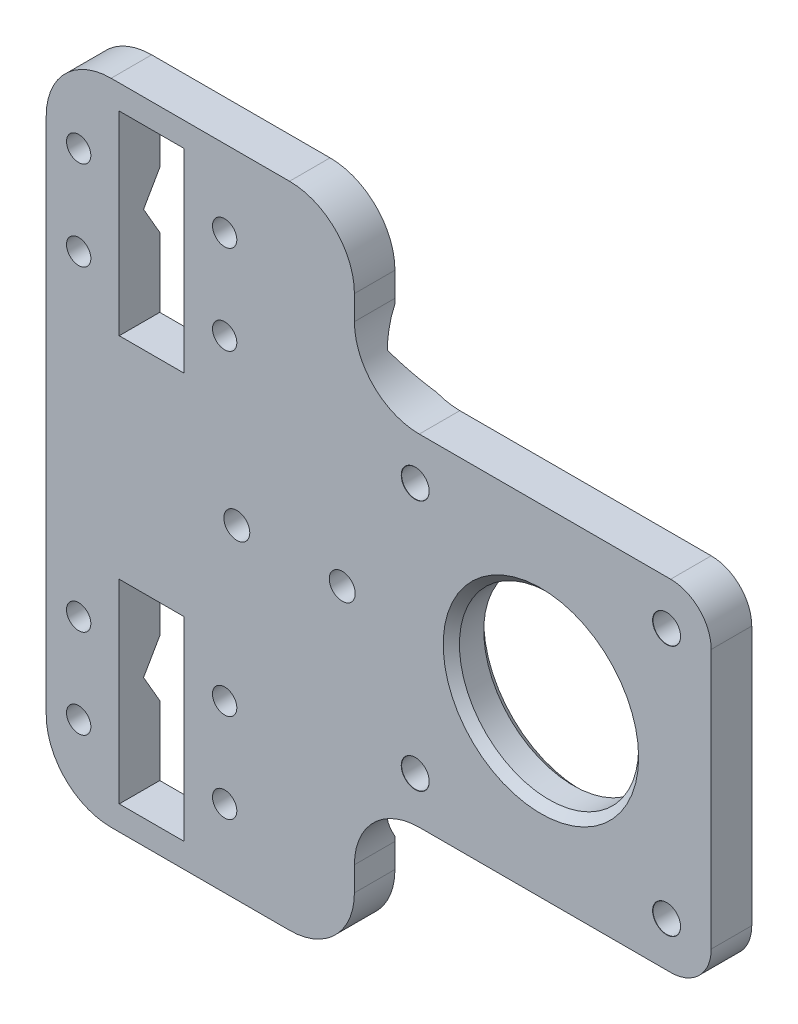
from build123d import *

# Parameters (mm, degrees)
ESBO_O1_W                                    = 82
ESBO_O1_H                                    = 80
ESBO_O1_R                                    = 1.5
ESBO_O1_W_2                                  = 8
ESBO_O1_H_2                                  = 24
RESSALTO_EXTRUS_O1_DEPTH                     = 5
CORTE_EXTRUS_O1_DEPTH                        = 92.372862492
ESCAREADO_PARA_PARAFUSO_COM_CABE_A_E_2_COUNT = 2
ESCAREADO_PARA_PARAFUSO_COM_CABE_A_E_2_PITCH = 31
ESCAREADO_PARA_PARAFUSO_COM_CABE_A_E_3_COUNT = 2
ESCAREADO_PARA_PARAFUSO_COM_CABE_A_E_3_PITCH = 43.840620434
ESCAREADO_PARA_PARAFUSO_COM_CABE_A_E_4_COUNT = 2
ESCAREADO_PARA_PARAFUSO_COM_CABE_A_E_4_PITCH = 31
ESBO_O5_R                                    = 11.05
CORTE_EXTRUS_O2_DEPTH                        = 58.497826046
CHANFRO1_SIZE                                = 1
ESBO_O6_W                                    = 44
ESBO_O6_H                                    = 19
CORTE_EXTRUS_O3_DEPTH                        = 10
FILETE1_R                                    = 8
FILETE2_R                                    = 5
ESBO_O7_R                                    = 1.6
CORTE_EXTRUS_O5_DEPTH                        = 58.497826046


with BuildPart() as part:
    # Esboço1 → Ressalto-extrusão1 (new body)
    with BuildSketch(Plane.XY):
        Rectangle(ESBO_O1_W, ESBO_O1_H)
        with Locations((-37, 19.5)):
            Circle(ESBO_O1_R, mode=Mode.SUBTRACT)
        with Locations(Location((-37, -19.5, 0), (0, 0, 180))):
            Circle(ESBO_O1_R, mode=Mode.SUBTRACT)
        with Locations((-19, -19.5)):
            Circle(ESBO_O1_R, mode=Mode.SUBTRACT)
        with Locations(Location((-19, 19.5, 0), (0, 0, 180))):
            Circle(ESBO_O1_R, mode=Mode.SUBTRACT)
        with Locations((-19, 30.5)):
            Circle(ESBO_O1_R, mode=Mode.SUBTRACT)
        with Locations(Location((-37, 30.5, 0), (0, 0, 180))):
            Circle(ESBO_O1_R, mode=Mode.SUBTRACT)
        with Locations((-37, -30.5)):
            Circle(ESBO_O1_R, mode=Mode.SUBTRACT)
        with Locations(Location((-19, -30.5, 0), (0, 0, 180))):
            Circle(ESBO_O1_R, mode=Mode.SUBTRACT)
        with Locations((-28, 25)):
            Rectangle(ESBO_O1_W_2, ESBO_O1_H_2, mode=Mode.SUBTRACT)
        with Locations((-28, -25)):
            Rectangle(ESBO_O1_W_2, ESBO_O1_H_2, mode=Mode.SUBTRACT)
    extrude(amount=RESSALTO_EXTRUS_O1_DEPTH)

    # Esboço2 → Corte-extrusão1 (cut, through all)
    with BuildSketch(Plane(origin=(41, 0, 0), x_dir=(0, 0, -1), z_dir=(1, 0, 0))):
        Polygon((-2, 25), (0, 28.464101615), (0, 21.535898385), align=None)
        Polygon((-2, -25), (0, -21.535898385), (0, -28.464101615), align=None)
    extrude(amount=-CORTE_EXTRUS_O1_DEPTH, mode=Mode.SUBTRACT)

    # Esboço3 → Escareado para parafuso com cabeça escareada elevada de M31 (revolve, cut)
    with BuildSketch(Plane(origin=(35.5, 15.5, 0), x_dir=(0, 1, 0), z_dir=(1, 0, 0))):
        Polygon((0, 0), (0, 5), (1.725, 5), (1.7, 4.975), (1.7, 1.45), (3.15, 0), align=None)
    escareado_para_parafuso_com_cabe_a_escar = revolve(axis=Axis((35.5, 15.5, -6.35), (0, 0, 1)), mode=Mode.SUBTRACT)

    # Escareado para parafuso com cabe_a e 2: Escareado para parafuso com cabeça escareada elevada de M31 ×2
    with Locations(*[(-i * ESCAREADO_PARA_PARAFUSO_COM_CABE_A_E_2_PITCH, 0, 0) for i in range(1, ESCAREADO_PARA_PARAFUSO_COM_CABE_A_E_2_COUNT)]):
        add(escareado_para_parafuso_com_cabe_a_escar, mode=Mode.SUBTRACT)

    # Escareado para parafuso com cabe_a e 3: Escareado para parafuso com cabeça escareada elevada de M31 ×2
    with Locations(*[Vector(-0.7071067811865476, -0.7071067811865476, 0) * (i * ESCAREADO_PARA_PARAFUSO_COM_CABE_A_E_3_PITCH) for i in range(1, ESCAREADO_PARA_PARAFUSO_COM_CABE_A_E_3_COUNT)]):
        add(escareado_para_parafuso_com_cabe_a_escar, mode=Mode.SUBTRACT)

    # Escareado para parafuso com cabe_a e 4: Escareado para parafuso com cabeça escareada elevada de M31 ×2
    with Locations(*[(0, -i * ESCAREADO_PARA_PARAFUSO_COM_CABE_A_E_4_PITCH, 0) for i in range(1, ESCAREADO_PARA_PARAFUSO_COM_CABE_A_E_4_COUNT)]):
        add(escareado_para_parafuso_com_cabe_a_escar, mode=Mode.SUBTRACT)

    # Esboço5 → Corte-extrusão2 (cut, through all)
    with BuildSketch(Plane.XY.offset(5)):
        with Locations((20, 0)):
            Circle(ESBO_O5_R)
    extrude(amount=-CORTE_EXTRUS_O2_DEPTH, mode=Mode.SUBTRACT)

    # Chanfro1
    chanfro1_edges = [part.edges().sort_by_distance(p)[0] for p in [
        (8.95, 0, 0),
        (8.95, 0, 5),
    ]]
    chamfer(chanfro1_edges, length=CHANFRO1_SIZE)

    # Esboço6 → Corte-extrusão3 (cut)
    with BuildSketch(Plane.XY):
        with Locations((19, 30.5)):
            Rectangle(ESBO_O6_W, ESBO_O6_H)
        with Locations((19, -30.5)):
            Rectangle(ESBO_O6_W, ESBO_O6_H)
    extrude(amount=CORTE_EXTRUS_O3_DEPTH, mode=Mode.SUBTRACT)

    # Filete1
    filete1_edges = [part.edges().sort_by_distance(p)[0] for p in [
        (-3, 21, 2.5),
        (-3, -21, 2.5),
        (-3, -40, 2.5),
        (-41, -40, 2.5),
        (-41, 40, 2.5),
        (-3, 40, 2.5),
    ]]
    fillet(filete1_edges, radius=FILETE1_R)

    # Filete2
    filete2_edges = [part.edges().sort_by_distance(p)[0] for p in [
        (41, 21, 2.5),
        (41, -21, 2.5),
    ]]
    fillet(filete2_edges, radius=FILETE2_R)

    # Esboço7 → Corte-extrusão5 (cut, through all)
    with BuildSketch(Plane.XY):
        with Locations((-17.5, 0)):
            Circle(ESBO_O7_R)
        with Locations(Location((-4.5, 0, 0), (0, 0, 180))):
            Circle(ESBO_O7_R)
    extrude(amount=CORTE_EXTRUS_O5_DEPTH, mode=Mode.SUBTRACT)


solid = part.part
